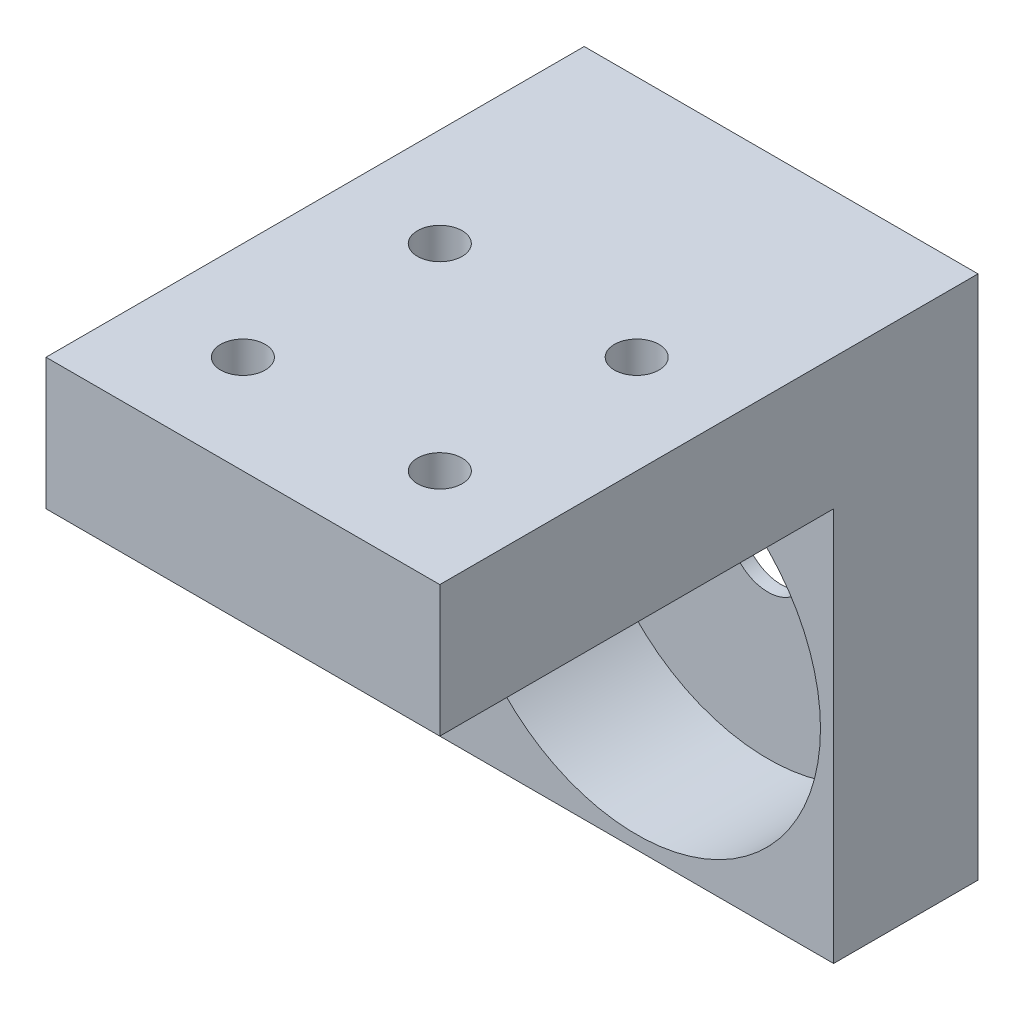
from build123d import *

# Parameters (mm, degrees)
SKETCH1_W           = 30
SKETCH1_H           = 30
BOSS_EXTRUDE1_DEPTH = 11
SKETCH2_R           = 14
CUT_EXTRUDE1_DEPTH  = 10
SKETCH3_R           = 3
CUT_EXTRUDE2_DEPTH  = 1
SKETCH4_W           = 30
SKETCH4_H           = 41
BOSS_EXTRUDE2_DEPTH = 10
SKETCH5_R           = 1.7
CUT_EXTRUDE3_DEPTH  = 60


with BuildPart() as part:
    # Sketch1 → Boss-Extrude1 (new body)
    with BuildSketch(Plane.XY):
        with Locations((15, 15)):
            Rectangle(SKETCH1_W, SKETCH1_H)
    extrude(amount=BOSS_EXTRUDE1_DEPTH)

    # Sketch2 → Cut-Extrude1 (cut)
    with BuildSketch(Plane.XY.offset(11)):
        with Locations((15, 15)):
            Circle(SKETCH2_R)
    extrude(amount=-CUT_EXTRUDE1_DEPTH, mode=Mode.SUBTRACT)

    # Sketch3 → Cut-Extrude2 (cut)
    with BuildSketch(Plane.XY.offset(1)):
        with Locations((15, 15)):
            Circle(SKETCH3_R)
    extrude(amount=-CUT_EXTRUDE2_DEPTH, mode=Mode.SUBTRACT)

    # Sketch4 → Boss-Extrude2 (add)
    with BuildSketch(Plane(origin=(0, 30, 0), x_dir=(1, 0, 0), z_dir=(0, 1, 0))):
        with Locations((15, -20.5)):
            Rectangle(SKETCH4_W, SKETCH4_H)
    extrude(amount=BOSS_EXTRUDE2_DEPTH)

    # Sketch5 → Cut-Extrude3 (cut, through all)
    with BuildSketch(Plane.XZ.offset(-30)):
        with Locations(Location((7.5, 33.5, 0), (0, 0, 270))):
            Circle(SKETCH5_R)
        with Locations(Location((22.5, 33.5, 0), (0, 0, 270))):
            Circle(SKETCH5_R)
        with Locations(Location((7.5, 18.5, 0), (0, 0, 270))):
            Circle(SKETCH5_R)
        with Locations(Location((22.5, 18.5, 0), (0, 0, 270))):
            Circle(SKETCH5_R)
    extrude(amount=-CUT_EXTRUDE3_DEPTH, mode=Mode.SUBTRACT)


solid = part.part
